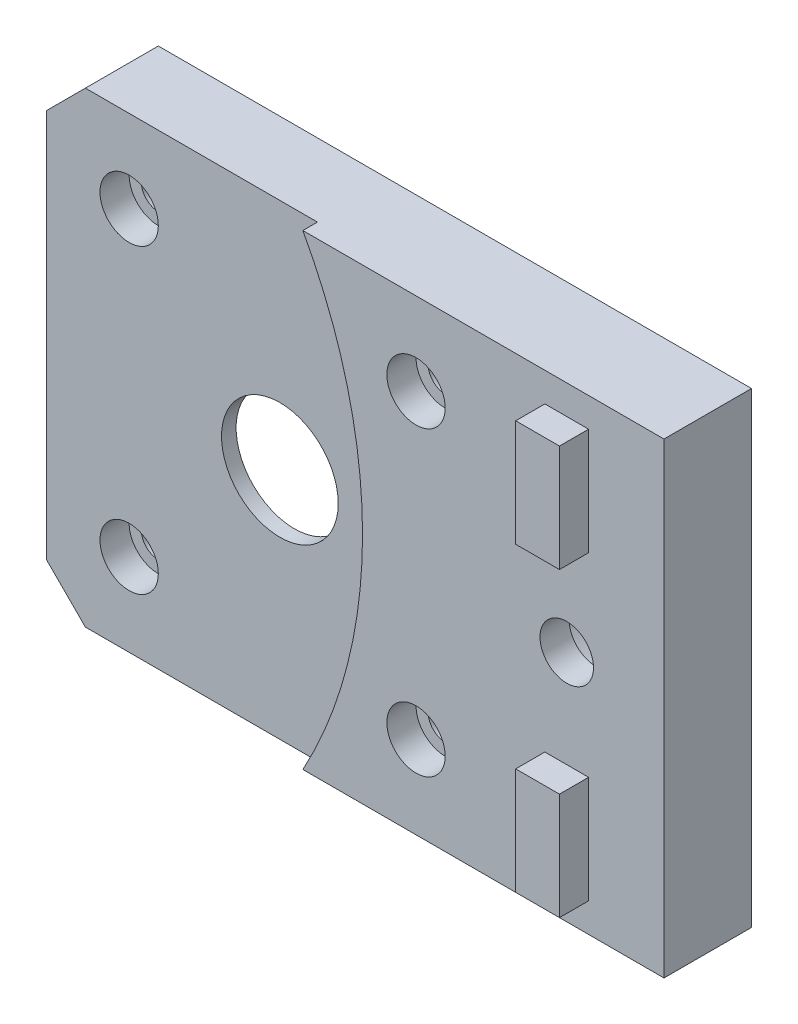
from build123d import *

# Parameters (mm, degrees)
SKETCH1_W                = 20
SKETCH1_H                = 42
SKETCH1_W_2              = 42
BOSS_EXTRUDE1_DEPTH      = 6
SKETCH2_R                = 11.25
CUT_EXTRUDE1_DEPTH       = 3
CUT_EXTRUDE2_DEPTH       = 47.454278597
CUT_EXTRUDE2_DEPTH_BACK  = 47.454278597
SKETCH3_R                = 1.75
SKETCH3_R_2              = 6
CUT_EXTRUDE3_START       = -3
SKETCH4_R                = 3
SKETCH4_R_2              = 1.75
CUT_EXTRUDE3_DEPTH       = 3
SKETCH5_W                = 4.5
SKETCH5_H                = 42
BOSS_EXTRUDE2_DEPTH      = 3
CHAMFER1_SIZE            = 3
CUT_EXTRUDE4_DEPTH       = 47.936126811
CUT_EXTRUDE4_DEPTH_BACK  = 47.936126811
SKETCH6_R                = 2.75
SKETCH7_W                = 9.456435582
SKETCH7_H                = 20
SKETCH7_R                = 2.75
CUT_EXTRUDE5_DEPTH       = 47.454278597
BOSS_EXTRUDE4_DEPTH      = 3
BOSS_EXTRUDE4_DEPTH_BACK = 6
SKETCH8_W                = 20
SKETCH8_H                = 42
SKETCH8_R                = 7
CHAMFER2_SIZE            = 4
SKETCH9_R                = 50
CUT_EXTRUDE7_DEPTH       = 1.5
CUT_EXTRUDE8_START       = -1.5
SKETCH10_R               = 3
CUT_EXTRUDE8_DEPTH       = 1.5
CUT_EXTRUDE9_START       = -3
SKETCH11_R               = 7
CUT_EXTRUDE9_DEPTH       = 3


with BuildPart() as part:
    # Sketch1 → Boss-Extrude1 (new body)
    with BuildSketch(Plane.XY):
        with Locations((31, 0)):
            Rectangle(SKETCH1_W, SKETCH1_H)
        Rectangle(SKETCH1_W_2, SKETCH1_H)
    extrude(amount=BOSS_EXTRUDE1_DEPTH)

    # Sketch2 → Cut-Extrude1 (cut)
    with BuildSketch(Plane.XY):
        Circle(SKETCH2_R)
    extrude(amount=CUT_EXTRUDE1_DEPTH, mode=Mode.SUBTRACT)

    # Sketch3 → Cut-Extrude2 (cut, two sides: drawn at the far end of the back side and taken through both)
    with BuildSketch(Plane.XY.offset(-CUT_EXTRUDE2_DEPTH_BACK)):
        with Locations((-15.499780644, 15.499780644)):
            Circle(SKETCH3_R)
        Circle(SKETCH3_R_2)
        with Locations((15.499780644, 15.499780644)):
            Circle(SKETCH3_R)
        with Locations((15.499780644, -15.499780644)):
            Circle(SKETCH3_R)
        with Locations((-15.499780644, -15.499780644)):
            Circle(SKETCH3_R)
    extrude(amount=CUT_EXTRUDE2_DEPTH + CUT_EXTRUDE2_DEPTH_BACK, mode=Mode.SUBTRACT)

    # Sketch4 → Cut-Extrude3 (cut)
    # profile 1 of 4: a face of its own
    with BuildSketch(Plane.XY.offset(6).offset(CUT_EXTRUDE3_START)):
        with Locations((-15.499780644, -15.499780644)):
            Circle(SKETCH4_R)
        with Locations((-15.499780644, -15.499780644)):
            Circle(SKETCH4_R_2, mode=Mode.SUBTRACT)
    # profile 2 of 4: a face of its own
    with BuildSketch(Plane.XY.offset(6).offset(CUT_EXTRUDE3_START)):
        with Locations((-15.499780644, 15.499780644)):
            Circle(SKETCH4_R)
        with Locations((-15.499780644, 15.499780644)):
            Circle(SKETCH4_R_2, mode=Mode.SUBTRACT)
    # profile 3 of 4: a face of its own
    with BuildSketch(Plane.XY.offset(6).offset(CUT_EXTRUDE3_START)):
        with Locations((15.499780644, 15.499780644)):
            Circle(SKETCH4_R)
        with Locations((15.499780644, 15.499780644)):
            Circle(SKETCH4_R_2, mode=Mode.SUBTRACT)
    # profile 4 of 4: a face of its own
    with BuildSketch(Plane.XY.offset(6).offset(CUT_EXTRUDE3_START)):
        with Locations((15.499780644, -15.499780644)):
            Circle(SKETCH4_R)
        with Locations((15.499780644, -15.499780644)):
            Circle(SKETCH4_R_2, mode=Mode.SUBTRACT)
    extrude(amount=CUT_EXTRUDE3_DEPTH, mode=Mode.SUBTRACT)

    # Sketch5 → Boss-Extrude2 (add)
    with BuildSketch(Plane.XY.offset(6)):
        with Locations((31, 0)):
            Rectangle(SKETCH5_W, SKETCH5_H)
    extrude(amount=BOSS_EXTRUDE2_DEPTH)

    # Chamfer1
    chamfer1_edges = [part.edges().sort_by_distance(p)[0] for p in [
        (-21, -21, 3),
        (-21, 21, 3),
    ]]
    chamfer(chamfer1_edges, length=CHAMFER1_SIZE)

    # Sketch6 → Cut-Extrude4 (cut, two sides: drawn at the far end of the back side and taken through both)
    with BuildSketch(Plane(origin=(0, 0, 0), x_dir=(-1, 0, 0), z_dir=(0, 0, -1)).offset(-CUT_EXTRUDE4_DEPTH_BACK)):
        with Locations(Location((-31, 0, 0), (0, 0, 324.903198772))):
            Circle(SKETCH6_R)
    extrude(amount=CUT_EXTRUDE4_DEPTH + CUT_EXTRUDE4_DEPTH_BACK, mode=Mode.SUBTRACT)

    # Sketch7 → Cut-Extrude5 (cut, through all)
    with BuildSketch(Plane.XY.offset(6)):
        with Locations((31, 0)):
            Rectangle(SKETCH7_W, SKETCH7_H)
        with Locations((31, 0)):
            Circle(SKETCH7_R, mode=Mode.SUBTRACT)
    extrude(amount=CUT_EXTRUDE5_DEPTH, mode=Mode.SUBTRACT)

    # Sketch8 → Boss-Extrude4 (add, two sides: drawn at the far end of the back side and taken through both)
    # profile 1 of 2: a face of its own
    with BuildSketch(Plane(origin=(0, 0, 0), x_dir=(-1, 0, 0), z_dir=(0, 0, -1)).offset(-BOSS_EXTRUDE4_DEPTH_BACK)):
        Polygon((18, -21), (-21, -21), (-41, -21), (-41, -24), (24, -24), (24, 24), (-41, 24), (-41, 21), (-21, 21), (18, 21), (21, 18), (21, -18), align=None)
    # profile 2 of 2: a face of its own
    with BuildSketch(Plane(origin=(0, 0, 0), x_dir=(-1, 0, 0), z_dir=(0, 0, -1)).offset(-BOSS_EXTRUDE4_DEPTH_BACK)):
        with Locations((-31, 0)):
            Rectangle(SKETCH8_W, SKETCH8_H)
        with Locations((-31, 0)):
            Circle(SKETCH8_R, mode=Mode.SUBTRACT)
    extrude(amount=BOSS_EXTRUDE4_DEPTH + BOSS_EXTRUDE4_DEPTH_BACK)

    # Chamfer2
    chamfer2_edges = [part.edges().sort_by_distance(p)[0] for p in [
        (-24, 24, 1.5),
        (-24, -24, 1.5),
    ]]
    chamfer(chamfer2_edges, length=CHAMFER2_SIZE)

    # Sketch9 → Cut-Extrude7 (cut)
    with BuildSketch(Plane.XY.offset(6)):
        with Locations((-40, 0)):
            Circle(SKETCH9_R)
    extrude(amount=-CUT_EXTRUDE7_DEPTH, mode=Mode.SUBTRACT)

    # Sketch10 → Cut-Extrude8 (cut)
    with BuildSketch(Plane.XY.offset(3).offset(CUT_EXTRUDE8_START)):
        with Locations((-15.499780644, 15.499780644)):
            Circle(SKETCH10_R)
        with Locations((-15.499780644, -15.499780644)):
            Circle(SKETCH10_R)
    extrude(amount=CUT_EXTRUDE8_DEPTH, mode=Mode.SUBTRACT)

    # Sketch11 → Cut-Extrude9 (cut)
    with BuildSketch(Plane(origin=(0, 0, 0), x_dir=(-1, 0, 0), z_dir=(0, 0, -1)).offset(CUT_EXTRUDE9_START)):
        with Locations((-31, 0)):
            Circle(SKETCH11_R)
    extrude(amount=CUT_EXTRUDE9_DEPTH, mode=Mode.SUBTRACT)


solid = part.part
